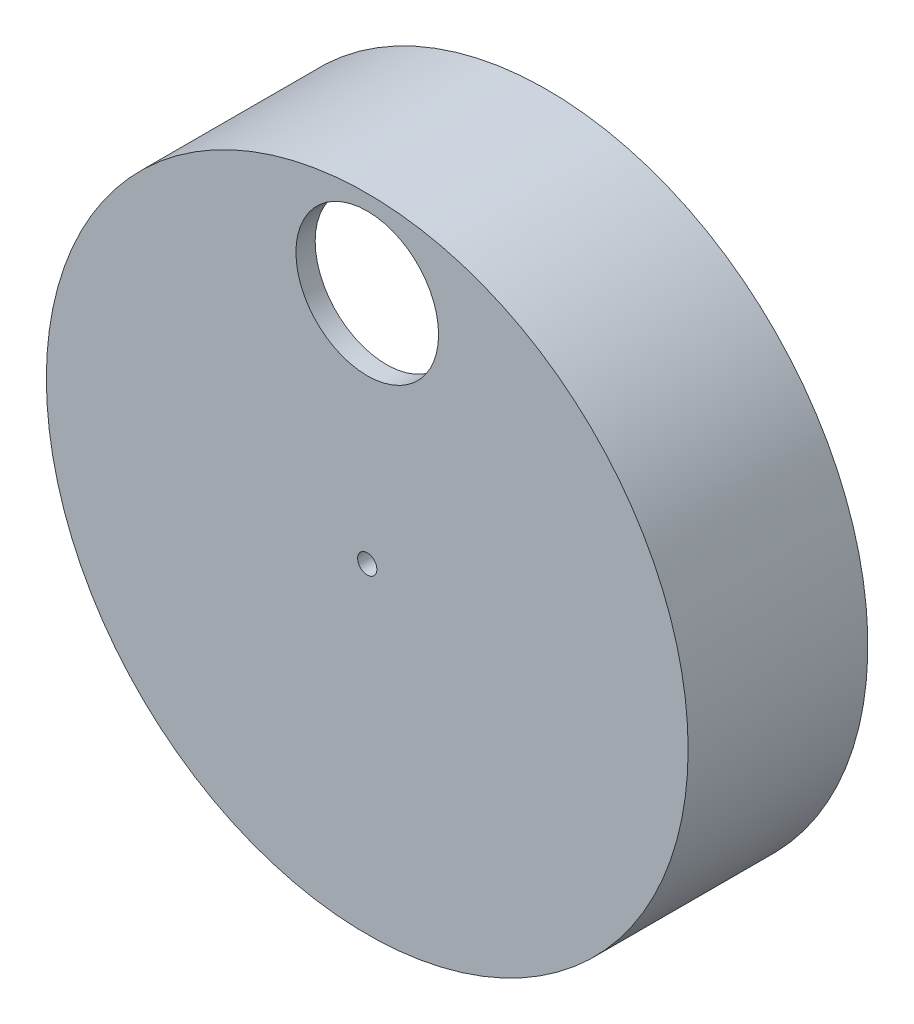
from build123d import *

# Parameters (mm, degrees)
SKETCH1_R           = 100
BOSS_EXTRUDE1_DEPTH = 6
BOSS_EXTRUDE2_START = 50
SKETCH2_R           = 100
SKETCH2_R_2         = 97
BOSS_EXTRUDE2_DEPTH = 50
SKETCH4_R           = 22.225
CUT_EXTRUDE2_DEPTH  = 50
SKETCH5_R           = 3
CUT_EXTRUDE3_DEPTH  = 50


with BuildPart() as part:
    # Sketch1 → Boss-Extrude1 (new body)
    with BuildSketch(Plane.XY):
        Circle(SKETCH1_R)
    extrude(amount=BOSS_EXTRUDE1_DEPTH)

    # Sketch2 → Boss-Extrude2 (add)
    with BuildSketch(Plane(origin=(0, 0, 0), x_dir=(-1, 0, 0), z_dir=(0, 0, -1)).offset(BOSS_EXTRUDE2_START)):
        Circle(SKETCH2_R)
        Circle(SKETCH2_R_2, mode=Mode.SUBTRACT)
    extrude(amount=-BOSS_EXTRUDE2_DEPTH)

    # Sketch4 → Cut-Extrude2 (cut)
    with BuildSketch(Plane(origin=(0, 0, 0), x_dir=(-1, 0, 0), z_dir=(0, 0, -1))):
        with Locations((0, 73)):
            Circle(SKETCH4_R)
    extrude(amount=-CUT_EXTRUDE2_DEPTH, mode=Mode.SUBTRACT)

    # Sketch5 → Cut-Extrude3 (cut)
    with BuildSketch(Plane(origin=(0, 0, 0), x_dir=(-1, 0, 0), z_dir=(0, 0, -1))):
        Circle(SKETCH5_R)
    extrude(amount=-CUT_EXTRUDE3_DEPTH, mode=Mode.SUBTRACT)


solid = part.part
